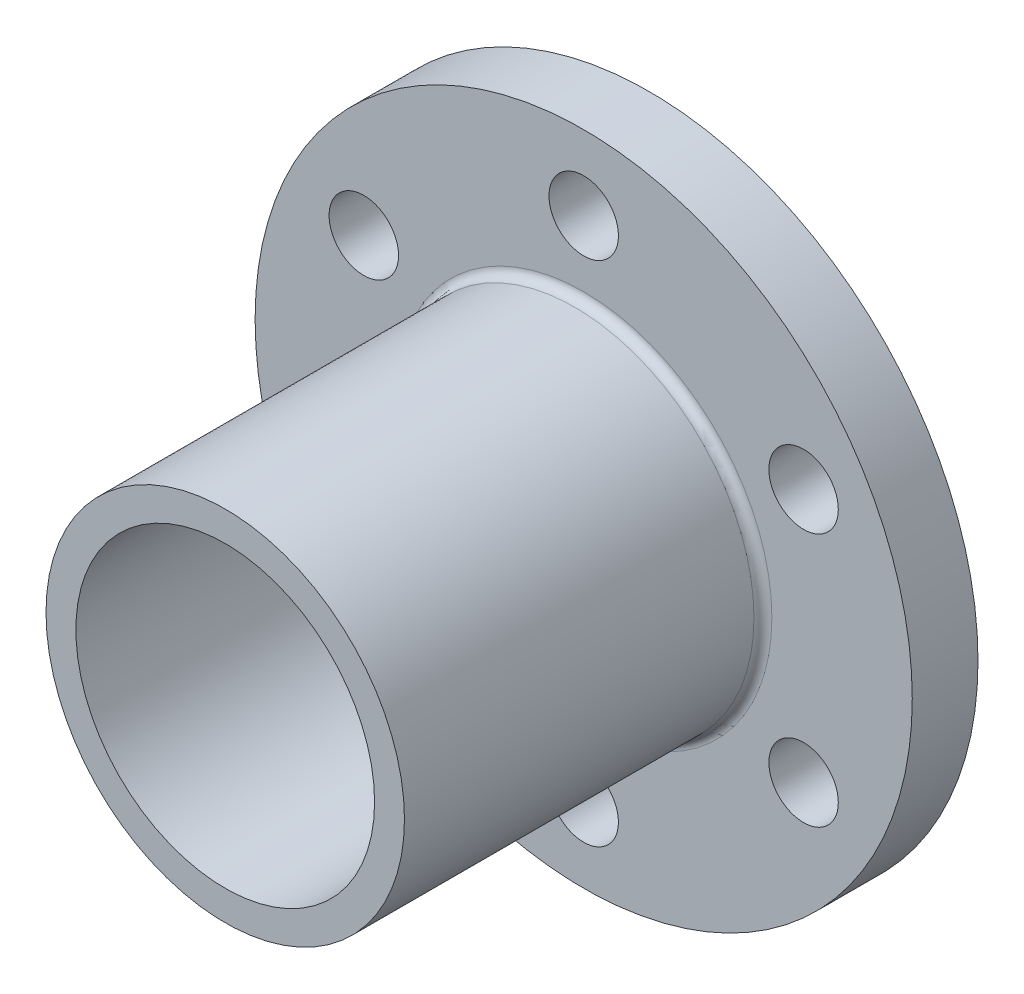
from build123d import *

# Parameters (mm, degrees)
SKETCH1_R           = 110
BOSS_EXTRUDE1_DEPTH = 22
SKETCH2_R           = 60
BOSS_EXTRUDE2_DEPTH = 120
SKETCH3_R           = 50
CUT_EXTRUDE1_DEPTH  = 211.627633515
SKETCH4_R           = 11.623448081
CUT_EXTRUDE2_DEPTH  = 197.468827044
FILLET1_R           = 3


with BuildPart() as part:
    # Sketch1 → Boss-Extrude1 (new body)
    with BuildSketch(Plane.XY):
        Circle(SKETCH1_R)
    extrude(amount=BOSS_EXTRUDE1_DEPTH)

    # Sketch2 → Boss-Extrude2 (add)
    with BuildSketch(Plane.XY.offset(22)):
        Circle(SKETCH2_R)
    extrude(amount=BOSS_EXTRUDE2_DEPTH)

    # Sketch3 → Cut-Extrude1 (cut, through all)
    with BuildSketch(Plane.XY.offset(142)):
        Circle(SKETCH3_R)
    extrude(amount=-CUT_EXTRUDE1_DEPTH, mode=Mode.SUBTRACT)

    # Sketch4 → Cut-Extrude2 (cut, through all)
    with BuildSketch(Plane.XY.offset(22)):
        with Locations((0, 85)):
            Circle(SKETCH4_R)
        with Locations((73.612159322, 42.5)):
            Circle(SKETCH4_R)
        with Locations((73.612159322, -42.5)):
            Circle(SKETCH4_R)
        with Locations((0, -85)):
            Circle(SKETCH4_R)
        with Locations((-73.612159322, -42.5)):
            Circle(SKETCH4_R)
        with Locations((-73.612159322, 42.5)):
            Circle(SKETCH4_R)
    extrude(amount=-CUT_EXTRUDE2_DEPTH, mode=Mode.SUBTRACT)

    # Fillet1
    fillet1_edges = [part.edges().sort_by_distance(p)[0] for p in [
        (-60, 0, 22),
    ]]
    fillet(fillet1_edges, radius=FILLET1_R)


solid = part.part
